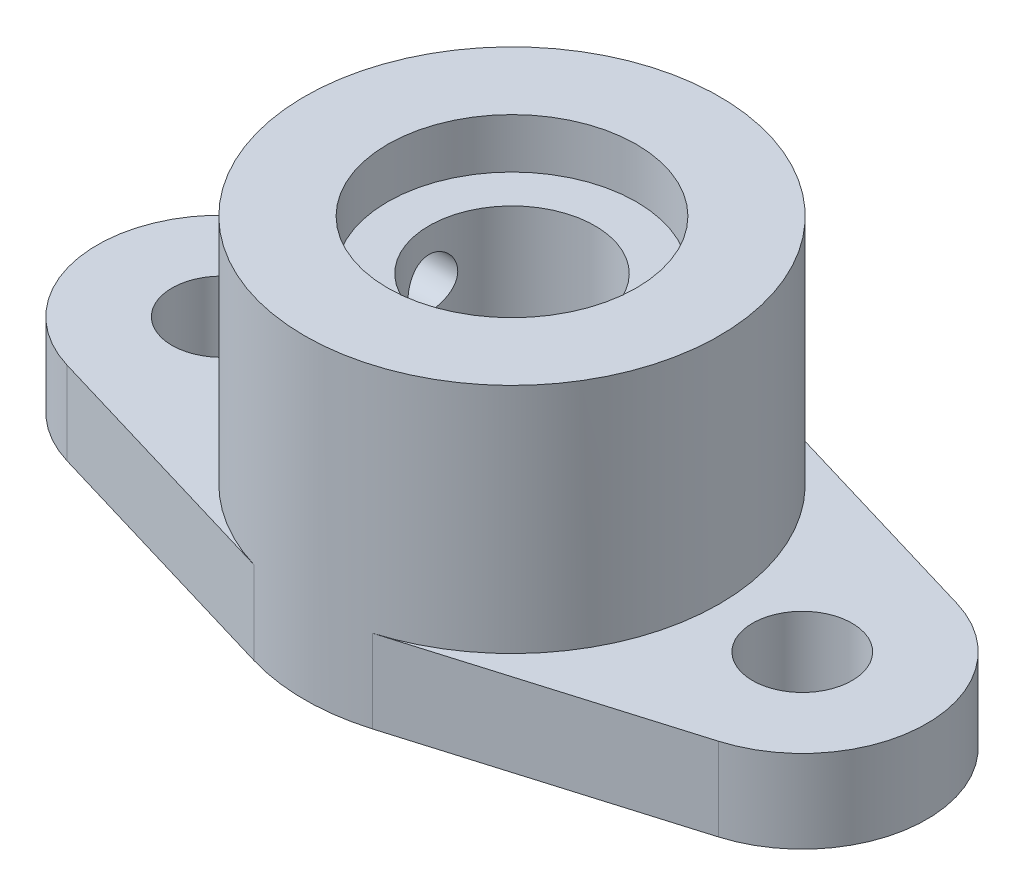
from build123d import *

# Parameters (mm, degrees)
SKETCH1_R             = 6
BOSS_EXTRUDE1_DEPTH   = 10
BOSS_EXTRUDE1_2_DEPTH = 10
SKETCH1_3_R           = 15
BOSS_EXTRUDE2_DEPTH   = 38
SKETCH1_4_R           = 15
SKETCH1_4_R_2         = 10
BOSS_EXTRUDE3_DEPTH   = 32
SKETCH4_R             = 3
CUT_EXTRUDE1_DEPTH    = 40


with BuildPart() as part:
    # Sketch1 → Boss-Extrude1 (new body)
    with BuildSketch(Plane(origin=(0, 0, 0), x_dir=(1, 0, 0), z_dir=(0, 1, 0))):
        with BuildLine():
            Line((-7.142857143, 23.957871187), (-39.285714286, 14.374722712))
            ThreePointArc((-39.285714286, 14.374722712), (-50, 0), (-39.285714286, -14.374722712))
            Line((-39.285714286, -14.374722712), (-7.142857143, -23.957871187))
            ThreePointArc((-7.142857143, -23.957871187), (-25, 0), (-7.142857143, 23.957871187))
        make_face()
        with Locations((-35, 0)):
            Circle(SKETCH1_R, mode=Mode.SUBTRACT)
    extrude(amount=BOSS_EXTRUDE1_DEPTH)



with BuildPart() as body_2:
    # Sketch1 → Boss-Extrude1 2 (new body)
    with BuildSketch(Plane(origin=(0, 0, 0), x_dir=(1, 0, 0), z_dir=(0, 1, 0))):
        with BuildLine():
            Line((39.285714286, 14.374722712), (7.142857143, 23.957871187))
            ThreePointArc((7.142857143, 23.957871187), (25, 0), (7.142857143, -23.957871187))
            Line((7.142857143, -23.957871187), (39.285714286, -14.374722712))
            ThreePointArc((39.285714286, -14.374722712), (50, 0), (39.285714286, 14.374722712))
        make_face()
        with Locations((35, 0)):
            Circle(SKETCH1_R, mode=Mode.SUBTRACT)
    extrude(amount=BOSS_EXTRUDE1_2_DEPTH)


with BuildPart() as part_1:
    add(part.part)

    add(body_2.part)  # Boss-Extrude2 merges body 2
    # Sketch1<3> → Boss-Extrude2 (add)
    with BuildSketch(Plane(origin=(0, 0, 0), x_dir=(1, 0, 0), z_dir=(0, 1, 0))):
        with BuildLine():
            ThreePointArc((7.142857143, 23.957871187), (0, 25), (-7.142857143, 23.957871187))
            ThreePointArc((-7.142857143, 23.957871187), (-25, 0), (-7.142857143, -23.957871187))
            ThreePointArc((-7.142857143, -23.957871187), (0, -25), (7.142857143, -23.957871187))
            ThreePointArc((7.142857143, -23.957871187), (20.044593143, -14.940357617), (25, 0))
            ThreePointArc((25, 0), (20.044593143, 14.940357617), (7.142857143, 23.957871187))
        make_face()
        Circle(SKETCH1_3_R, mode=Mode.SUBTRACT)
    extrude(amount=BOSS_EXTRUDE2_DEPTH)

    # Sketch1<4> → Boss-Extrude3 (add)
    with BuildSketch(Plane(origin=(0, 0, 0), x_dir=(1, 0, 0), z_dir=(0, 1, 0))):
        Circle(SKETCH1_4_R)
        Circle(SKETCH1_4_R_2, mode=Mode.SUBTRACT)
    extrude(amount=BOSS_EXTRUDE3_DEPTH)

    # Sketch4 → Cut-Extrude1 (cut)
    with BuildSketch(Plane(origin=(0, 0, 0), x_dir=(0, 0, -1), z_dir=(1, 0, 0))):
        with Locations((0, 26)):
            Circle(SKETCH4_R)
    extrude(amount=-CUT_EXTRUDE1_DEPTH, mode=Mode.SUBTRACT)


solid = part_1.part
